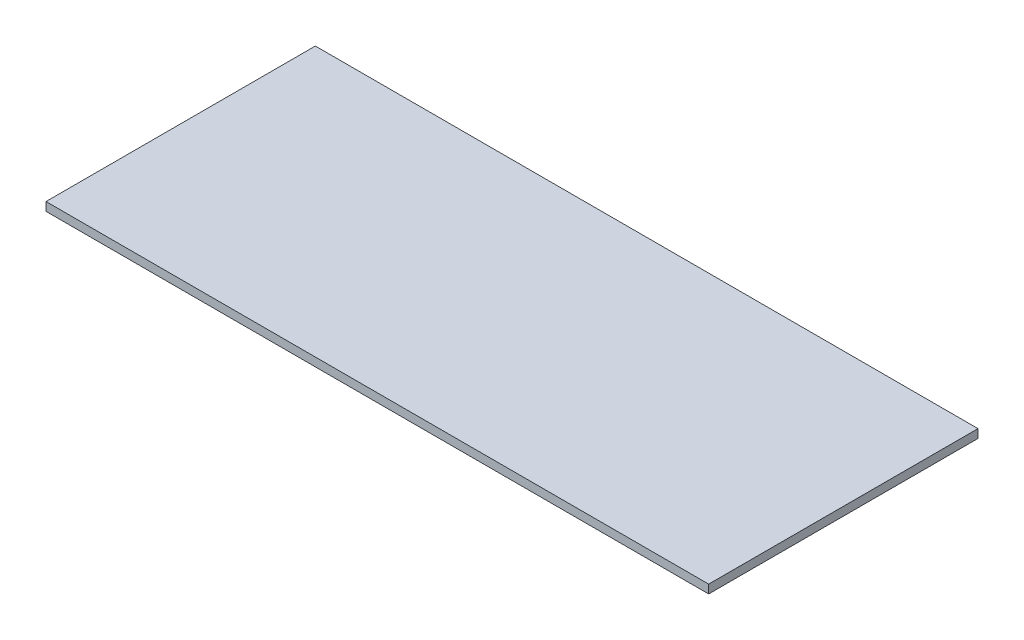
from build123d import *

# Parameters (mm, degrees)
SKETCH1_W           = 393.7
SKETCH1_H           = 160.02
BOSS_EXTRUDE1_DEPTH = 5.08


with BuildPart() as part:
    # Sketch1 → Boss-Extrude1 (new body)
    with BuildSketch(Plane(origin=(0, 0, 0), x_dir=(1, 0, 0), z_dir=(0, 1, 0))):
        Rectangle(SKETCH1_W, SKETCH1_H)
    extrude(amount=BOSS_EXTRUDE1_DEPTH)


solid = part.part
